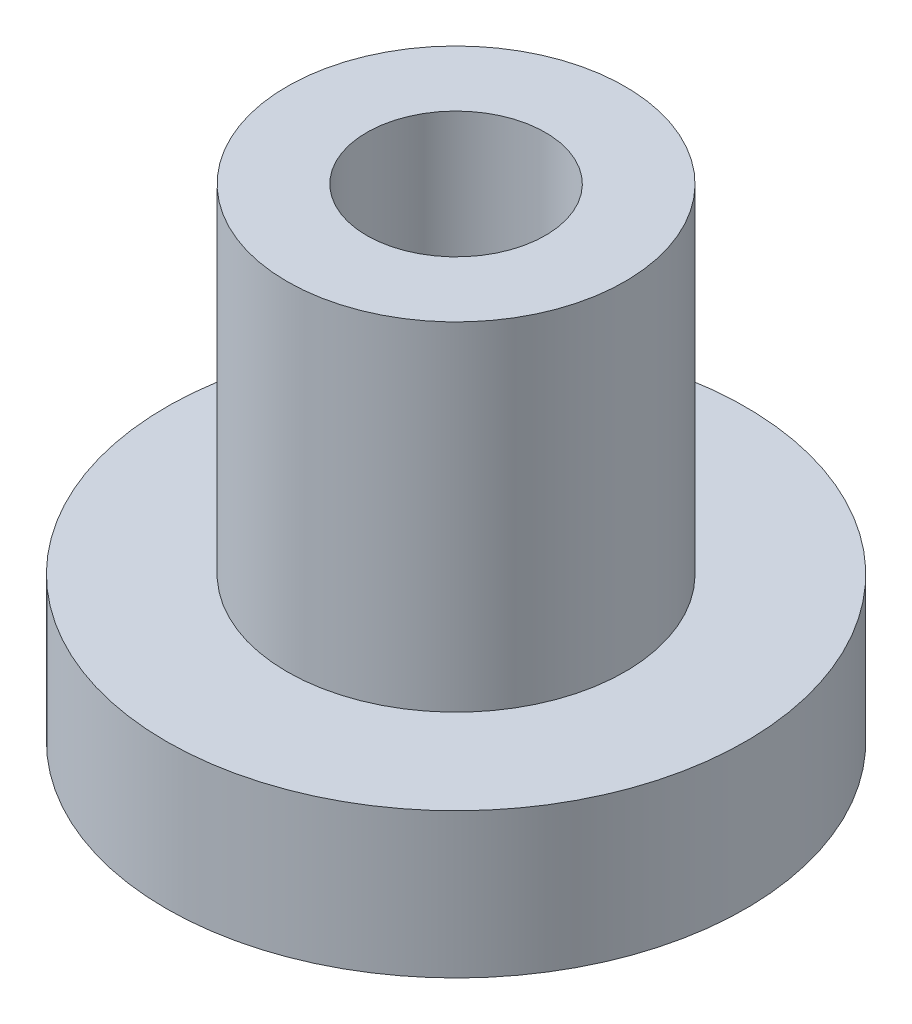
from build123d import *

# Parameters (mm, degrees)
SKETCH_1_R      = 6
SKETCH_1_R_2    = 1.85
EXTRUDE_1_DEPTH = 3
SKETCH_2_R      = 3.5
SKETCH_2_R_2    = 1.85
EXTRUDE_2_DEPTH = 7


with BuildPart() as part:
    # 草图1 → 凸台-拉伸1 (new body)
    with BuildSketch(Plane(origin=(0, 0, 0), x_dir=(1, 0, 0), z_dir=(0, 1, 0))):
        with Locations(Location((0, 0, 0), (0, 0, 270))):
            Circle(SKETCH_1_R)
        with Locations(Location((0, 0, 0), (0, 0, 270))):
            Circle(SKETCH_1_R_2, mode=Mode.SUBTRACT)
    extrude(amount=EXTRUDE_1_DEPTH)

    # 草图2 → 凸台-拉伸2 (add)
    with BuildSketch(Plane(origin=(0, 3, 0), x_dir=(1, 0, 0), z_dir=(0, 1, 0))):
        with Locations(Location((0, 0, 0), (0, 0, 270))):
            Circle(SKETCH_2_R)
        with Locations(Location((0, 0, 0), (0, 0, 270))):
            Circle(SKETCH_2_R_2, mode=Mode.SUBTRACT)
    extrude(amount=EXTRUDE_2_DEPTH)


solid = part.part
